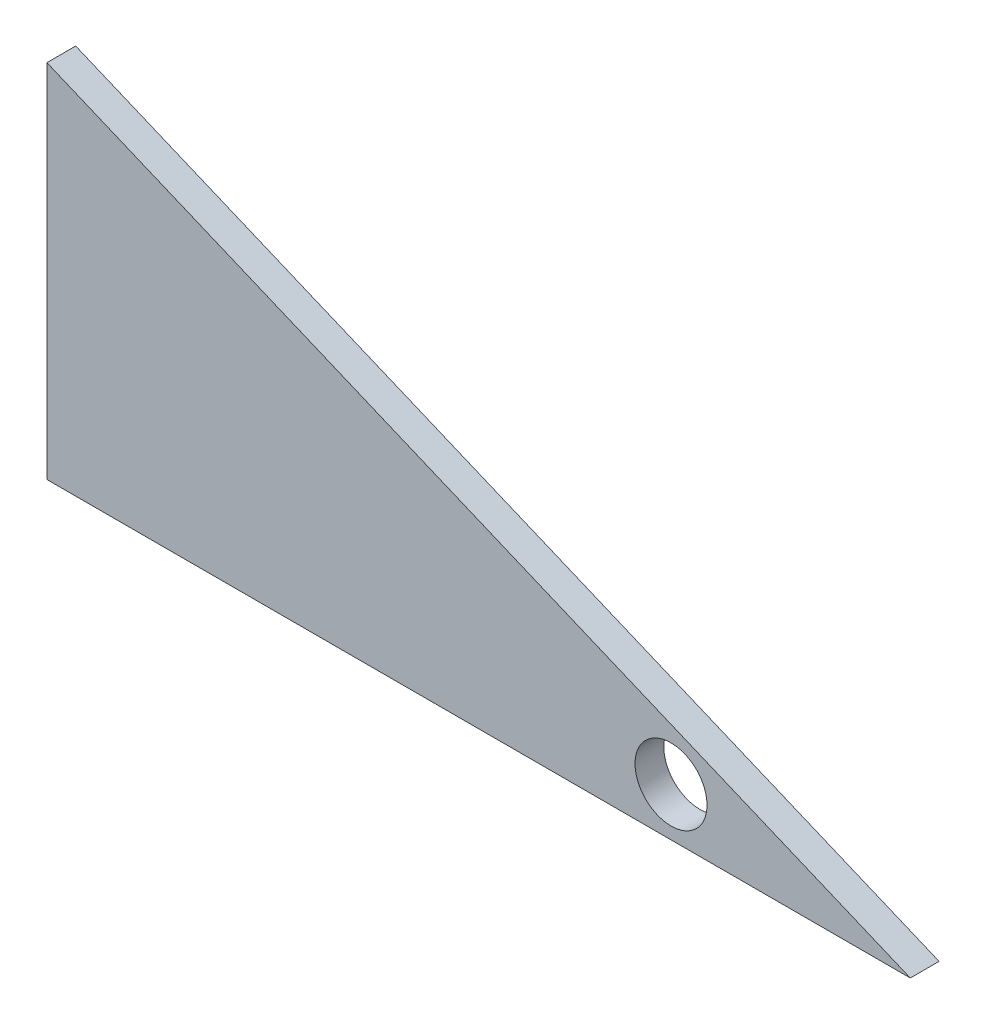
from build123d import *

# Parameters (mm, degrees)
SKETCH1_R           = 4.7625
BOSS_EXTRUDE1_DEPTH = 3.81


with BuildPart() as part:
    # Sketch1 → Boss-Extrude1 (new body)
    with BuildSketch(Plane.XY):
        Polygon((0, 0), (0, 47.752), (114.195290032, 0), align=None)
        with Locations(Location((82.55, 6.35, 0), (0, 0, 180))):
            Circle(SKETCH1_R, mode=Mode.SUBTRACT)
    extrude(amount=BOSS_EXTRUDE1_DEPTH)


solid = part.part
